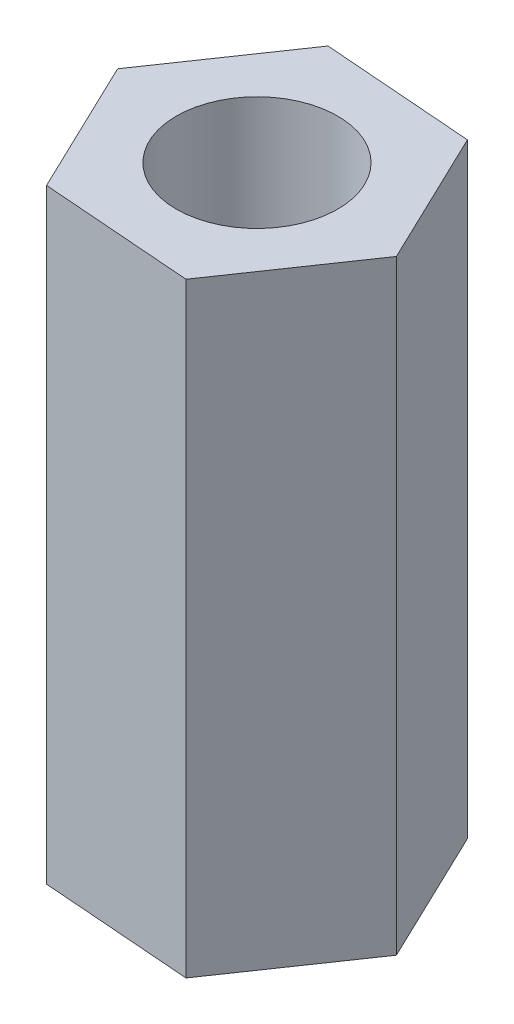
from build123d import *

# Parameters (mm, degrees)
SKETCH_1_R      = 1.6
EXTRUDE_1_DEPTH = 12


with BuildPart() as part:
    # 草图1 → 凸台-拉伸1 (new body)
    with BuildSketch(Plane(origin=(0, 0, 0), x_dir=(1, 0, 0), z_dir=(0, 1, 0))):
        Polygon((1.29843897, -2.70691514), (2.993476762, -0.228976437), (1.695037792, 2.477938703), (-1.29843897, 2.70691514), (-2.993476762, 0.228976437), (-1.695037792, -2.477938703), align=None)
        with Locations(Location((0, 0, 0), (0, 0, 270))):
            Circle(SKETCH_1_R, mode=Mode.SUBTRACT)
    extrude(amount=EXTRUDE_1_DEPTH)


solid = part.part
